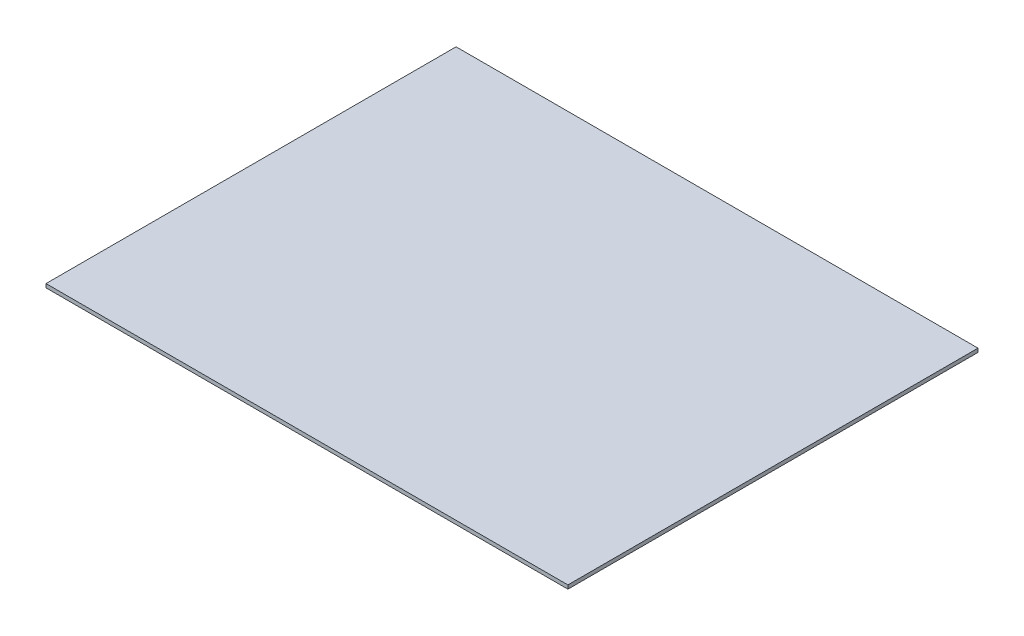
from build123d import *

# Parameters (mm, degrees)
SKETCH1_W           = 700
SKETCH1_H           = 550
BOSS_EXTRUDE1_DEPTH = 5


with BuildPart() as part:
    # Sketch1 → Boss-Extrude1 (new body)
    with BuildSketch(Plane(origin=(0, 0, 0), x_dir=(1, 0, 0), z_dir=(0, 1, 0))):
        with Locations((-350, -275)):
            Rectangle(SKETCH1_W, SKETCH1_H)
    extrude(amount=BOSS_EXTRUDE1_DEPTH)


solid = part.part
